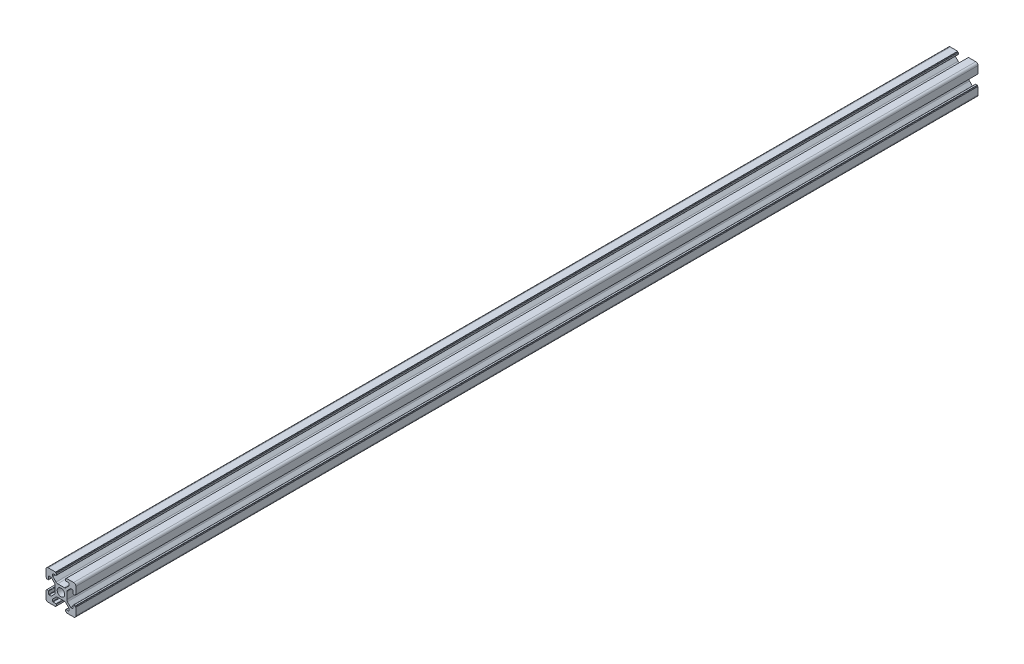
from build123d import *

# Parameters (mm, degrees)
SKETCH_1_R      = 2.5
EXTRUDE_1_DEPTH = 604


with BuildPart() as part:
    # 草图1 → 凸台-拉伸1 (new body)
    with BuildSketch(Plane.XY):
        with BuildLine():
            Line((4.215995631, 3.244230202), (6.436655803, 5.464890373))
            Line((6.436655803, 5.464890373), (7.776655803, 5.464890373))
            ThreePointArc((7.776655803, 5.464890373), (7.988787838, 5.377022408), (8.076655803, 5.164890373))
            Line((8.076655803, 5.164890373), (8.076655803, 3.364890373))
            ThreePointArc((8.076655803, 3.364890373), (8.164523769, 3.152758339), (8.376655803, 3.064890373))
            Line((8.376655803, 3.064890373), (9.376655803, 3.064890373))
            Line((9.376655803, 3.064890373), (9.376655803, 3.364890373))
            ThreePointArc((9.376655803, 3.364890373), (9.435234447, 3.50631173), (9.576655803, 3.564890373))
            Line((9.576655803, 3.564890373), (9.876655803, 3.564890373))
            Line((9.876655803, 3.564890373), (9.876655803, 8.464890373))
            ThreePointArc((9.876655803, 8.464890373), (9.437315975, 9.525550545), (8.376655803, 9.964890373))
            Line((8.376655803, 9.964890373), (3.476655803, 9.964890373))
            Line((3.476655803, 9.964890373), (3.476655803, 9.664890373))
            ThreePointArc((3.476655803, 9.664890373), (3.418077159, 9.523469017), (3.276655803, 9.464890373))
            Line((3.276655803, 9.464890373), (2.976655803, 9.464890373))
            Line((2.976655803, 9.464890373), (2.976655803, 8.464890373))
            ThreePointArc((2.976655803, 8.464890373), (3.064523769, 8.252758339), (3.276655803, 8.164890373))
            Line((3.276655803, 8.164890373), (5.076655803, 8.164890373))
            ThreePointArc((5.076655803, 8.164890373), (5.288787838, 8.077022408), (5.376655803, 7.864890373))
            Line((5.376655803, 7.864890373), (5.376655803, 6.524890373))
            Line((5.376655803, 6.524890373), (3.155995631, 4.304230202))
            ThreePointArc((3.155995631, 4.304230202), (2.669360608, 3.979071075), (2.09533546, 3.864890373))
            Line((2.09533546, 3.864890373), (-2.342023853, 3.864890373))
            ThreePointArc((-2.342023853, 3.864890373), (-2.916049002, 3.979071075), (-3.402684025, 4.304230202))
            Line((-3.402684025, 4.304230202), (-5.623344197, 6.524890373))
            Line((-5.623344197, 6.524890373), (-5.623344197, 7.864890373))
            ThreePointArc((-5.623344197, 7.864890373), (-5.535476231, 8.077022408), (-5.323344197, 8.164890373))
            Line((-5.323344197, 8.164890373), (-3.523344197, 8.164890373))
            ThreePointArc((-3.523344197, 8.164890373), (-3.311212162, 8.252758339), (-3.223344197, 8.464890373))
            Line((-3.223344197, 8.464890373), (-3.223344197, 9.464890373))
            Line((-3.223344197, 9.464890373), (-3.523344197, 9.464890373))
            ThreePointArc((-3.523344197, 9.464890373), (-3.664765553, 9.523469017), (-3.723344197, 9.664890373))
            Line((-3.723344197, 9.664890373), (-3.723344197, 9.964890373))
            Line((-3.723344197, 9.964890373), (-8.623344197, 9.964890373))
            ThreePointArc((-8.623344197, 9.964890373), (-9.684004369, 9.525550545), (-10.123344197, 8.464890373))
            Line((-10.123344197, 8.464890373), (-10.123344197, 3.564890373))
            Line((-10.123344197, 3.564890373), (-9.823344197, 3.564890373))
            ThreePointArc((-9.823344197, 3.564890373), (-9.681922841, 3.50631173), (-9.623344197, 3.364890373))
            Line((-9.623344197, 3.364890373), (-9.623344197, 3.064890373))
            Line((-9.623344197, 3.064890373), (-8.623344197, 3.064890373))
            ThreePointArc((-8.623344197, 3.064890373), (-8.411212162, 3.152758339), (-8.323344197, 3.364890373))
            Line((-8.323344197, 3.364890373), (-8.323344197, 5.164890373))
            ThreePointArc((-8.323344197, 5.164890373), (-8.235476231, 5.377022408), (-8.023344197, 5.464890373))
            Line((-8.023344197, 5.464890373), (-6.683344197, 5.464890373))
            Line((-6.683344197, 5.464890373), (-4.462684025, 3.244230202))
            ThreePointArc((-4.462684025, 3.244230202), (-4.137524898, 2.757595178), (-4.023344197, 2.18357003))
            Line((-4.023344197, 2.18357003), (-4.023344197, -2.253789283))
            ThreePointArc((-4.023344197, -2.253789283), (-4.137524898, -2.827814432), (-4.462684025, -3.314449455))
            Line((-4.462684025, -3.314449455), (-6.683344197, -5.535109627))
            Line((-6.683344197, -5.535109627), (-8.023344197, -5.535109627))
            ThreePointArc((-8.023344197, -5.535109627), (-8.235476231, -5.447241661), (-8.323344197, -5.235109627))
            Line((-8.323344197, -5.235109627), (-8.323344197, -3.435109627))
            ThreePointArc((-8.323344197, -3.435109627), (-8.411212162, -3.222977592), (-8.623344197, -3.135109627))
            Line((-8.623344197, -3.135109627), (-9.623344197, -3.135109627))
            Line((-9.623344197, -3.135109627), (-9.623344197, -3.435109627))
            ThreePointArc((-9.623344197, -3.435109627), (-9.681922841, -3.576530983), (-9.823344197, -3.635109627))
            Line((-9.823344197, -3.635109627), (-10.123344197, -3.635109627))
            Line((-10.123344197, -3.635109627), (-10.123344197, -8.535109627))
            ThreePointArc((-10.123344197, -8.535109627), (-9.684004369, -9.595769798), (-8.623344197, -10.035109627))
            Line((-8.623344197, -10.035109627), (-3.723344197, -10.035109627))
            Line((-3.723344197, -10.035109627), (-3.723344197, -9.735109627))
            ThreePointArc((-3.723344197, -9.735109627), (-3.664765553, -9.59368827), (-3.523344197, -9.535109627))
            Line((-3.523344197, -9.535109627), (-3.223344197, -9.535109627))
            Line((-3.223344197, -9.535109627), (-3.223344197, -8.535109627))
            ThreePointArc((-3.223344197, -8.535109627), (-3.311212162, -8.322977592), (-3.523344197, -8.235109627))
            Line((-3.523344197, -8.235109627), (-5.323344197, -8.235109627))
            ThreePointArc((-5.323344197, -8.235109627), (-5.535476231, -8.147241661), (-5.623344197, -7.935109627))
            Line((-5.623344197, -7.935109627), (-5.623344197, -6.595109627))
            Line((-5.623344197, -6.595109627), (-3.402684025, -4.374449455))
            ThreePointArc((-3.402684025, -4.374449455), (-2.916049002, -4.049290328), (-2.342023853, -3.935109627))
            Line((-2.342023853, -3.935109627), (2.09533546, -3.935109627))
            ThreePointArc((2.09533546, -3.935109627), (2.669360608, -4.049290328), (3.155995631, -4.374449455))
            Line((3.155995631, -4.374449455), (5.376655803, -6.595109627))
            Line((5.376655803, -6.595109627), (5.376655803, -7.935109627))
            ThreePointArc((5.376655803, -7.935109627), (5.288787838, -8.147241661), (5.076655803, -8.235109627))
            Line((5.076655803, -8.235109627), (3.276655803, -8.235109627))
            ThreePointArc((3.276655803, -8.235109627), (3.064523769, -8.322977592), (2.976655803, -8.535109627))
            Line((2.976655803, -8.535109627), (2.976655803, -9.535109627))
            Line((2.976655803, -9.535109627), (3.276655803, -9.535109627))
            ThreePointArc((3.276655803, -9.535109627), (3.418077159, -9.59368827), (3.476655803, -9.735109627))
            Line((3.476655803, -9.735109627), (3.476655803, -10.035109627))
            Line((3.476655803, -10.035109627), (8.376655803, -10.035109627))
            ThreePointArc((8.376655803, -10.035109627), (9.437315975, -9.595769798), (9.876655803, -8.535109627))
            Line((9.876655803, -8.535109627), (9.876655803, -3.635109627))
            Line((9.876655803, -3.635109627), (9.576655803, -3.635109627))
            ThreePointArc((9.576655803, -3.635109627), (9.435234447, -3.576530983), (9.376655803, -3.435109627))
            Line((9.376655803, -3.435109627), (9.376655803, -3.135109627))
            Line((9.376655803, -3.135109627), (8.376655803, -3.135109627))
            ThreePointArc((8.376655803, -3.135109627), (8.164523769, -3.222977592), (8.076655803, -3.435109627))
            Line((8.076655803, -3.435109627), (8.076655803, -5.235109627))
            ThreePointArc((8.076655803, -5.235109627), (7.988787838, -5.447241661), (7.776655803, -5.535109627))
            Line((7.776655803, -5.535109627), (6.436655803, -5.535109627))
            Line((6.436655803, -5.535109627), (4.215995631, -3.314449455))
            ThreePointArc((4.215995631, -3.314449455), (3.890836504, -2.827814432), (3.776655803, -2.253789283))
            Line((3.776655803, -2.253789283), (3.776655803, 2.18357003))
            ThreePointArc((3.776655803, 2.18357003), (3.890836504, 2.757595178), (4.215995631, 3.244230202))
        make_face()
        with Locations((-0.123344197, -0.035109627)):
            Circle(SKETCH_1_R, mode=Mode.SUBTRACT)
    extrude(amount=EXTRUDE_1_DEPTH)


solid = part.part
